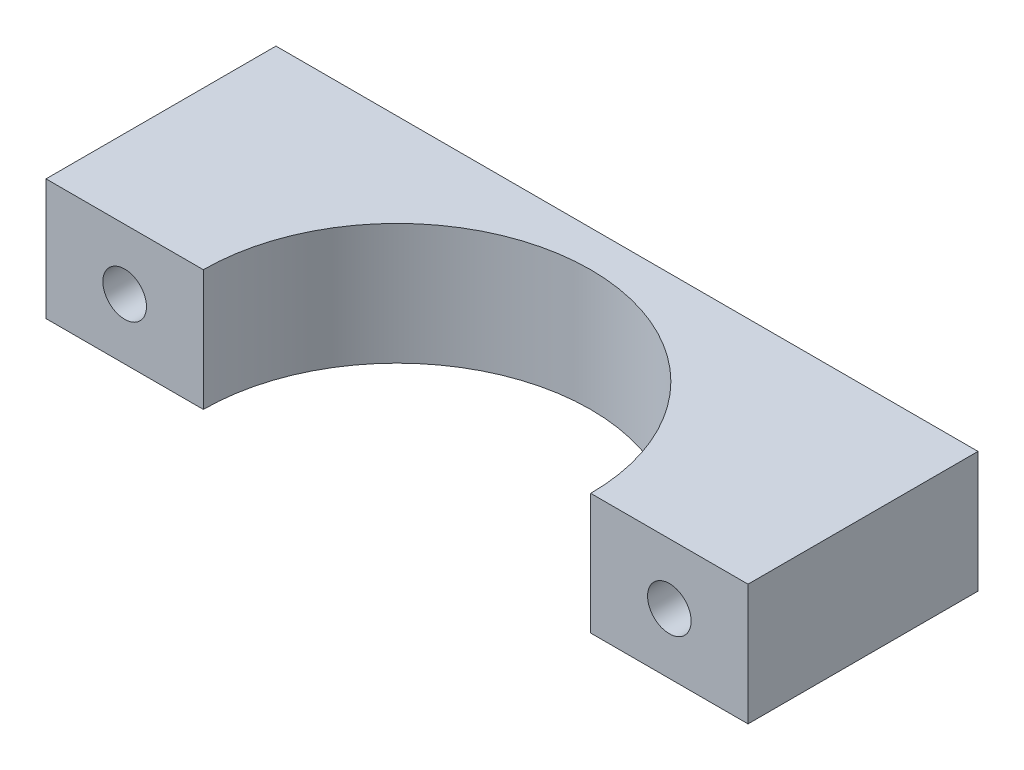
from build123d import *

# Parameters (mm, degrees)
EXTRUDE_2_DEPTH     = 10
SKETCH_8_R          = 1.8
CUT_EXTRUDE_3_DEPTH = 5
SKETCH_9_W          = 5.8
SKETCH_9_H          = 5.8
CUT_EXTRUDE_4_DEPTH = 14


with BuildPart() as part:
    # 草图1 → 凸台-拉伸2 (new body)
    with BuildSketch(Plane(origin=(0, 0, 0), x_dir=(1, 0, 0), z_dir=(0, 1, 0))):
        with BuildLine():
            Line((-69.33427814, 6.574466706), (-56.33427814, 6.574466706))
            ThreePointArc((-56.33427814, 6.574466706), (-40.33427814, 22.574466706), (-24.33427814, 6.574466706))
            Line((-24.33427814, 6.574466706), (-11.33427814, 6.574466706))
            Line((-11.33427814, 6.574466706), (-11.33427814, 25.574466706))
            Line((-11.33427814, 25.574466706), (-69.33427814, 25.574466706))
            Line((-69.33427814, 25.574466706), (-69.33427814, 6.574466706))
        make_face()
    extrude(amount=EXTRUDE_2_DEPTH)

    # 草图8 → 切除-拉伸3 (cut)
    with BuildSketch(Plane.XY.offset(-6.574466706)):
        with Locations((-62.83427814, 5)):
            Circle(SKETCH_8_R)
        with Locations((-17.83427814, 5)):
            Circle(SKETCH_8_R)
    extrude(amount=-CUT_EXTRUDE_3_DEPTH, mode=Mode.SUBTRACT)

    # 草图9 → 切除-拉伸4 (cut)
    with BuildSketch(Plane(origin=(0, 0, -25.574466706), x_dir=(-1, 0, 0), z_dir=(0, 0, -1))):
        with Locations((17.83427814, 5)):
            Rectangle(SKETCH_9_W, SKETCH_9_H)
        with Locations((62.83427814, 5)):
            Rectangle(SKETCH_9_W, SKETCH_9_H)
    extrude(amount=-CUT_EXTRUDE_4_DEPTH, mode=Mode.SUBTRACT)


solid = part.part
